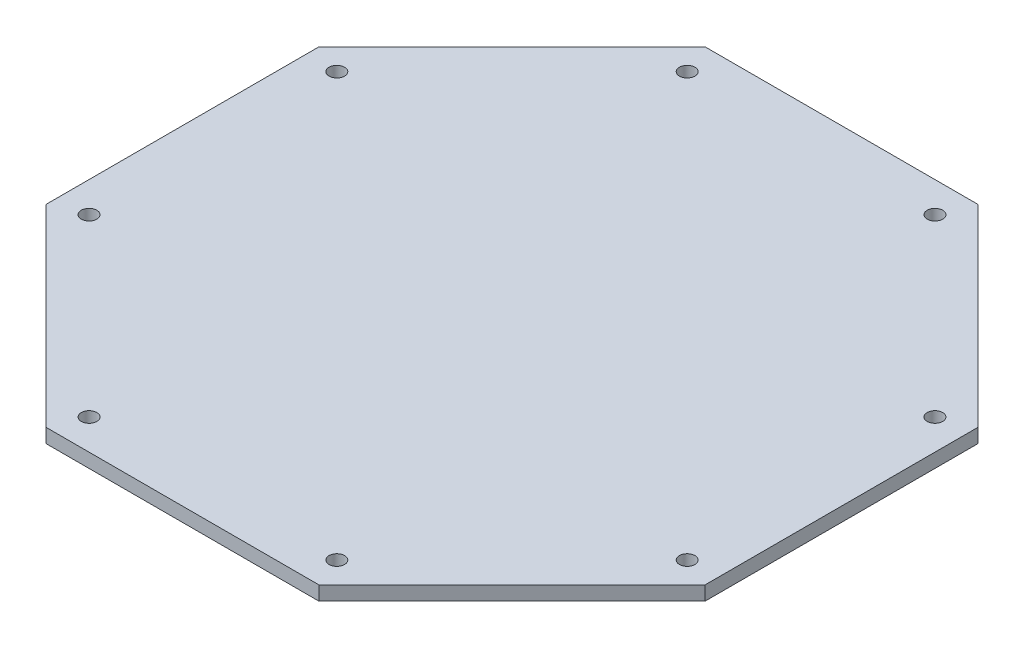
from build123d import *

# Parameters (mm, degrees)
RESSALTO_EXTRUS_O1_DEPTH = 1.5
ESBO_O2_R                = 1.65
CORTE_EXTRUS_O1_DEPTH    = 100.040395799


with BuildPart() as part:
    # Esboço1 → Ressalto-extrusão1 (new, symmetric)
    with BuildSketch(Plane(origin=(0, 0, 0), x_dir=(1, 0, 0), z_dir=(0, 1, 0))):
        Polygon((70, 28.994949366), (28.994949366, 70), (-28.994949366, 70), (-70, 28.994949366), (-70, -28.994949366), (-28.994949366, -70), (28.994949366, -70), (70, -28.994949366), align=None)
    extrude(amount=RESSALTO_EXTRUS_O1_DEPTH, both=True)

    # Esboço2 → Corte-extrusão1 (cut, through all)
    with BuildSketch(Plane.XZ.offset(1.5)):
        with Locations(Location((-26.31616534, 63.532843272, 0), (0, 0, 270))):
            Circle(ESBO_O2_R)
        with Locations(Location((26.31616534, 63.532843272, 0), (0, 0, 270))):
            Circle(ESBO_O2_R)
        with Locations(Location((63.532843272, 26.31616534, 0), (0, 0, 270))):
            Circle(ESBO_O2_R)
        with Locations(Location((63.532843272, -26.31616534, 0), (0, 0, 270))):
            Circle(ESBO_O2_R)
        with Locations(Location((26.31616534, -63.532843272, 0), (0, 0, 270))):
            Circle(ESBO_O2_R)
        with Locations(Location((-26.31616534, -63.532843272, 0), (0, 0, 270))):
            Circle(ESBO_O2_R)
        with Locations(Location((-63.532843272, 26.31616534, 0), (0, 0, 270))):
            Circle(ESBO_O2_R)
        with Locations(Location((-63.532843272, -26.31616534, 0), (0, 0, 270))):
            Circle(ESBO_O2_R)
    extrude(amount=-CORTE_EXTRUS_O1_DEPTH, mode=Mode.SUBTRACT)


solid = part.part
